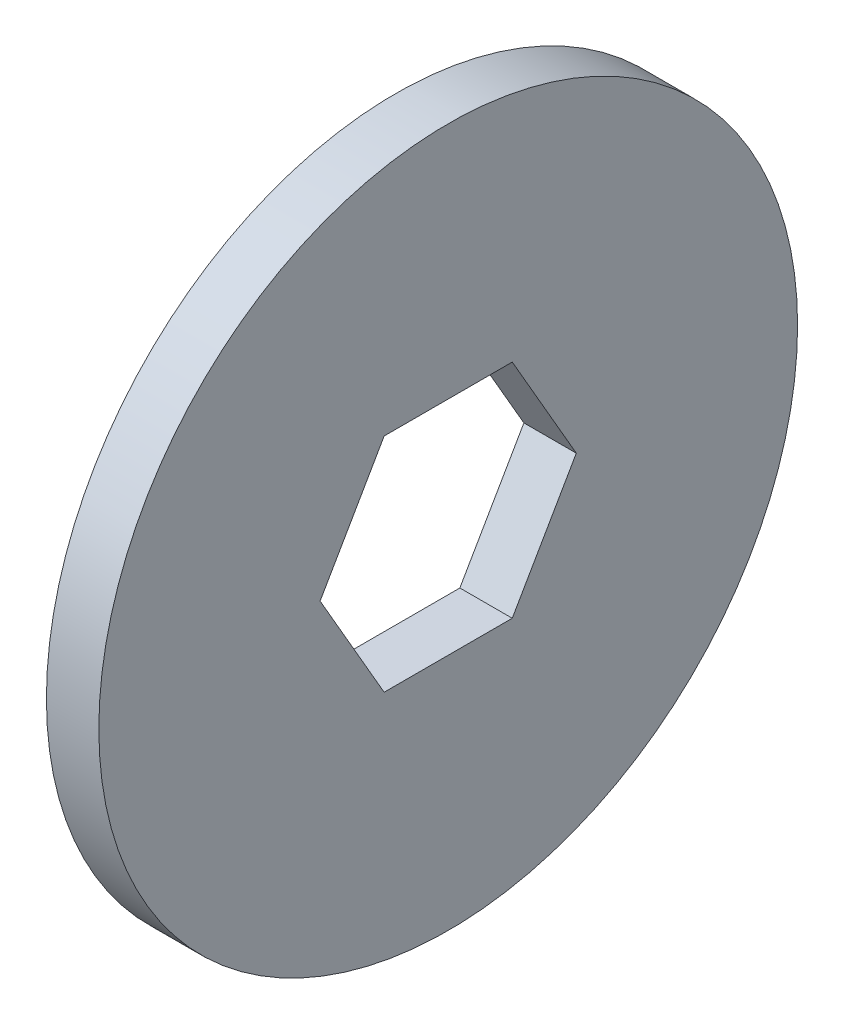
from build123d import *

# Parameters (mm, degrees)
CROQUIS1_R              = 20
SALIENTE_EXTRUIR1_DEPTH = 3


with BuildPart() as part:
    # Croquis1 → Saliente-Extruir1 (new body)
    with BuildSketch(Plane(origin=(0, 0, 0), x_dir=(0, 0, -1), z_dir=(1, 0, 0))):
        Circle(CROQUIS1_R)
        Polygon((7.332348419, 0), (3.666174209, 6.35), (-3.666174209, 6.35), (-7.332348419, 0), (-3.666174209, -6.35), (3.666174209, -6.35), align=None, mode=Mode.SUBTRACT)
    extrude(amount=SALIENTE_EXTRUIR1_DEPTH)


solid = part.part
